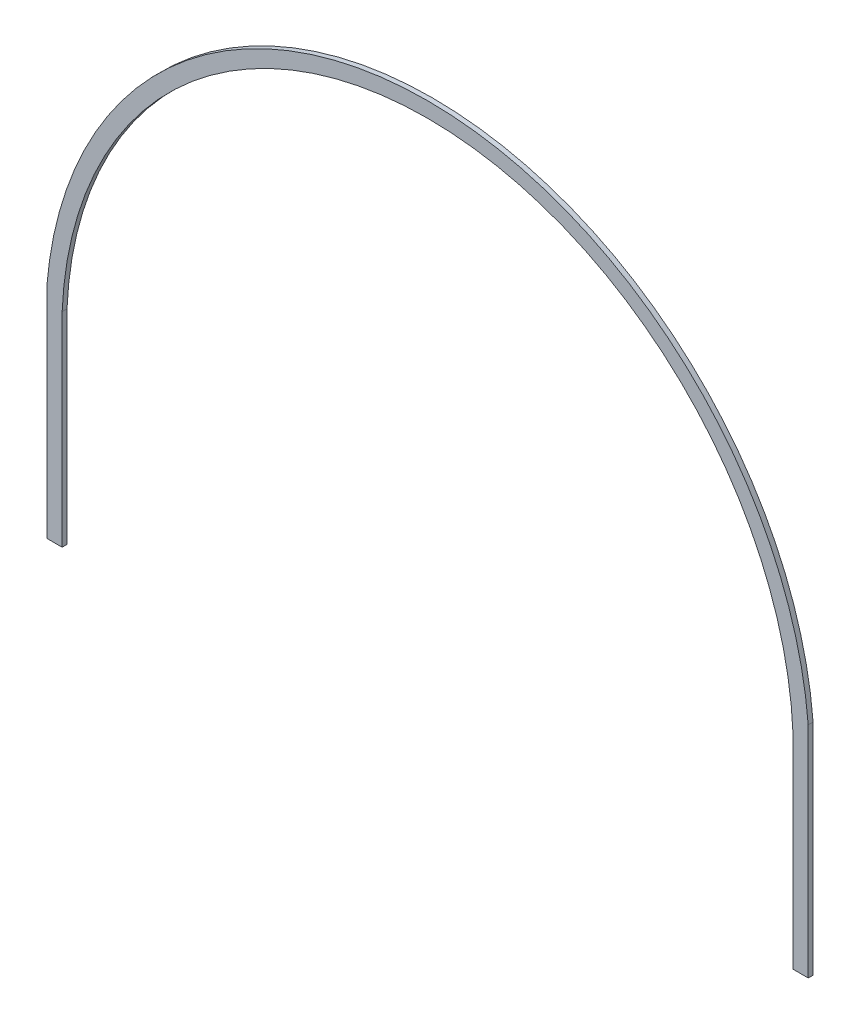
from build123d import *

# Parameters (mm, degrees)
BOSS_EXTRU_1_DEPTH = 1.6


with BuildPart() as part:
    # Esquisse1 → Boss.-Extru.1 (new body)
    with BuildSketch(Plane.XY):
        with BuildLine():
            Line((5, 0), (5, 67))
            ThreePointArc((5, 67), (125, 182), (245, 67))
            Line((245, 67), (245, 0))
            Line((245, 0), (250, 0))
            Line((250, 0), (250, 72))
            ThreePointArc((250, 72), (125, 187), (0, 72))
            Line((0, 72), (0, 0))
            Line((0, 0), (5, 0))
        make_face()
    extrude(amount=BOSS_EXTRU_1_DEPTH)


solid = part.part
